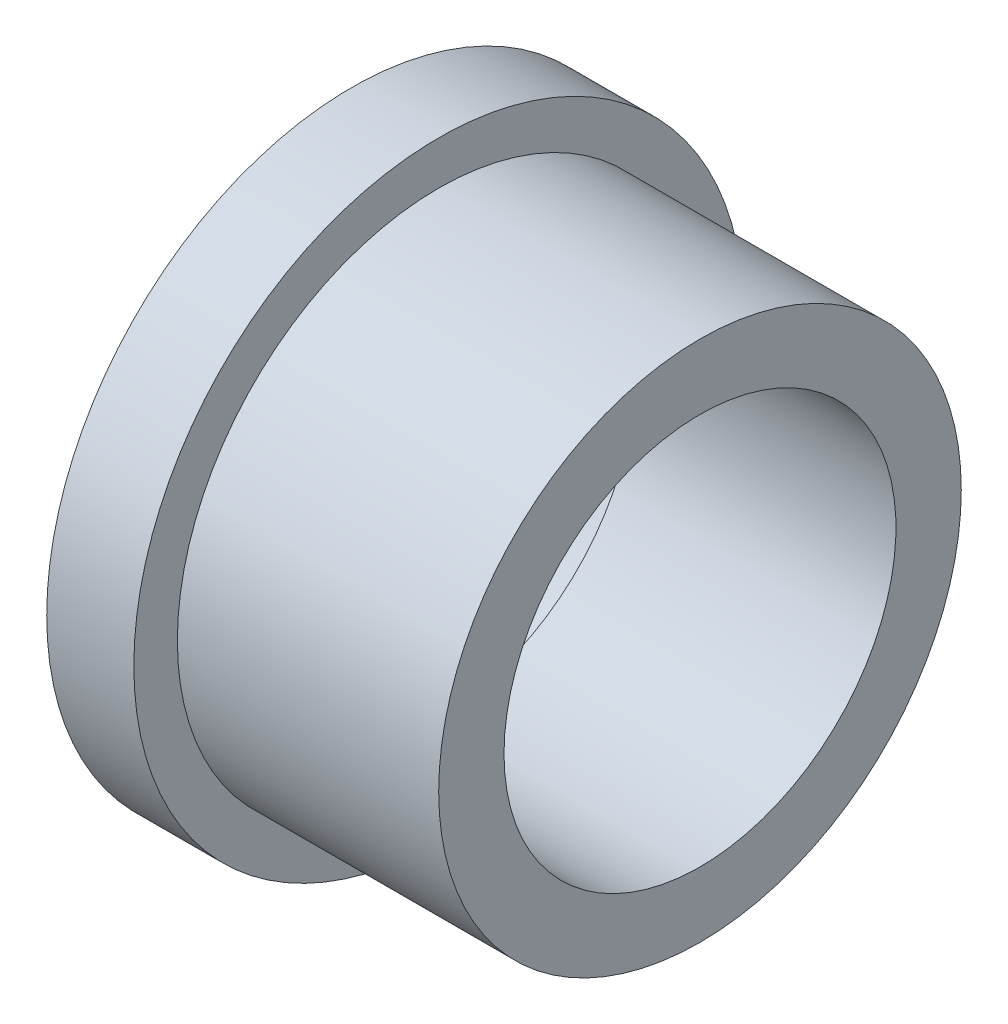
from build123d import *


with BuildPart() as part:
    # Sketch1 → Revolve1 (revolve)
    with BuildSketch(Plane.XY, mode=Mode.PRIVATE) as revolve1_sk:
        Polygon((0, 2.1), (0, 3.5), (1, 3.5), (1, 3), (4, 3), (4, 2.25), (1, 2.25), (1, 2.6), (0.5, 2.6), (0.5, 2.1), align=None)
    revolve(revolve1_sk.sketch.rotate(Axis((0, 0, 0), (1, 0, 0)), 90), axis=Axis((0, 0, 0), (1, 0, 0)))


solid = part.part
